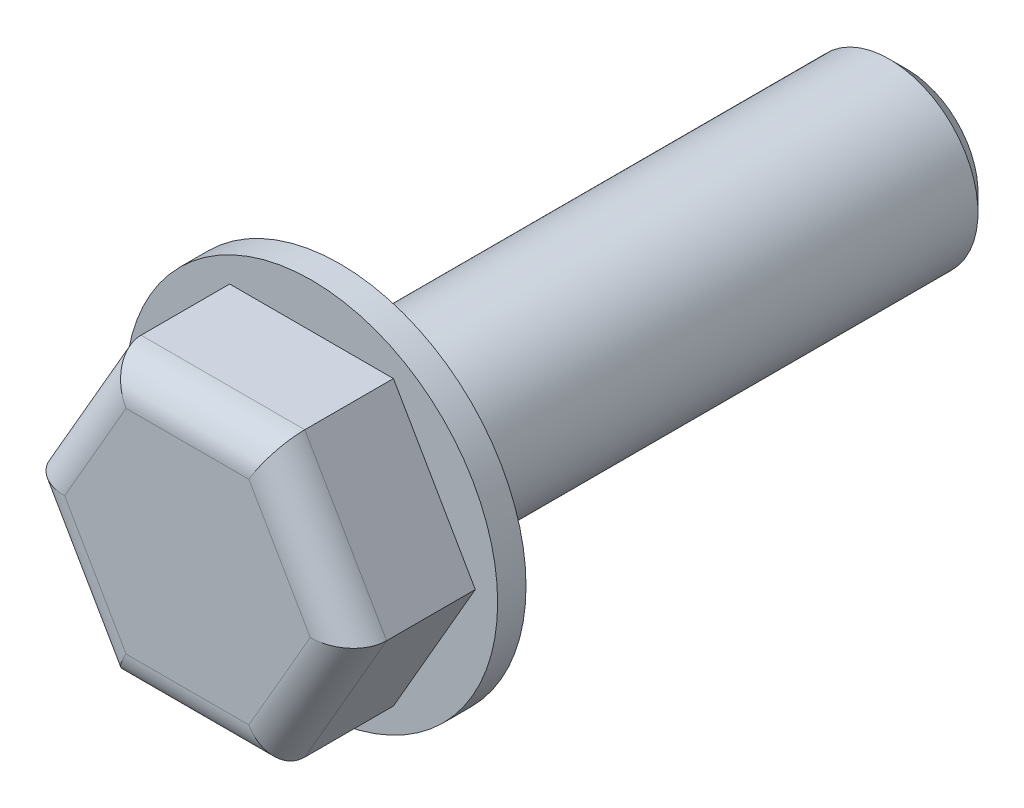
from build123d import *

# Parameters (mm, degrees)
SKETCH_2_R      = 5.25
EXTRUDE_1_DEPTH = 0.8
EXTRUDE_2_DEPTH = 3.5
SKETCH_4_R      = 2.5
EXTRUDE_3_DEPTH = 16
FILLET_1_R      = 1
CHAMFER_1_SIZE  = 0.5


with BuildPart() as part:
    # Эскиз2 → Бобышка-Вытянуть1 (new body)
    with BuildSketch(Plane.XY):
        Circle(SKETCH_2_R)
    extrude(amount=EXTRUDE_1_DEPTH)

    # Эскиз3 → Бобышка-Вытянуть2 (add)
    with BuildSketch(Plane.XY.offset(0.8)):
        Polygon((-2.309401077, 4), (-4.618802154, 0), (-2.309401077, -4), (2.309401077, -4), (4.618802154, 0), (2.309401077, 4), align=None)
    extrude(amount=EXTRUDE_2_DEPTH)

    # Эскиз4 → Бобышка-Вытянуть3 (add)
    with BuildSketch(Plane(origin=(0, 0, 0), x_dir=(-1, 0, 0), z_dir=(0, 0, -1))):
        Circle(SKETCH_4_R)
    extrude(amount=EXTRUDE_3_DEPTH)

    # Скругление1
    fillet_1_edges = [part.edges().sort_by_distance(p)[0] for p in [
        (0, 4, 4.3),
        (-3.464101615, 2, 4.3),
        (-3.464101615, -2, 4.3),
        (0, -4, 4.3),
        (3.464101615, -2, 4.3),
        (3.464101615, 2, 4.3),
    ]]
    fillet(fillet_1_edges, radius=FILLET_1_R)

    # Фаска1
    chamfer_1_edges = [part.edges().sort_by_distance(p)[0] for p in [
        (2.5, 0, -16),
    ]]
    chamfer(chamfer_1_edges, length=CHAMFER_1_SIZE)


solid = part.part
